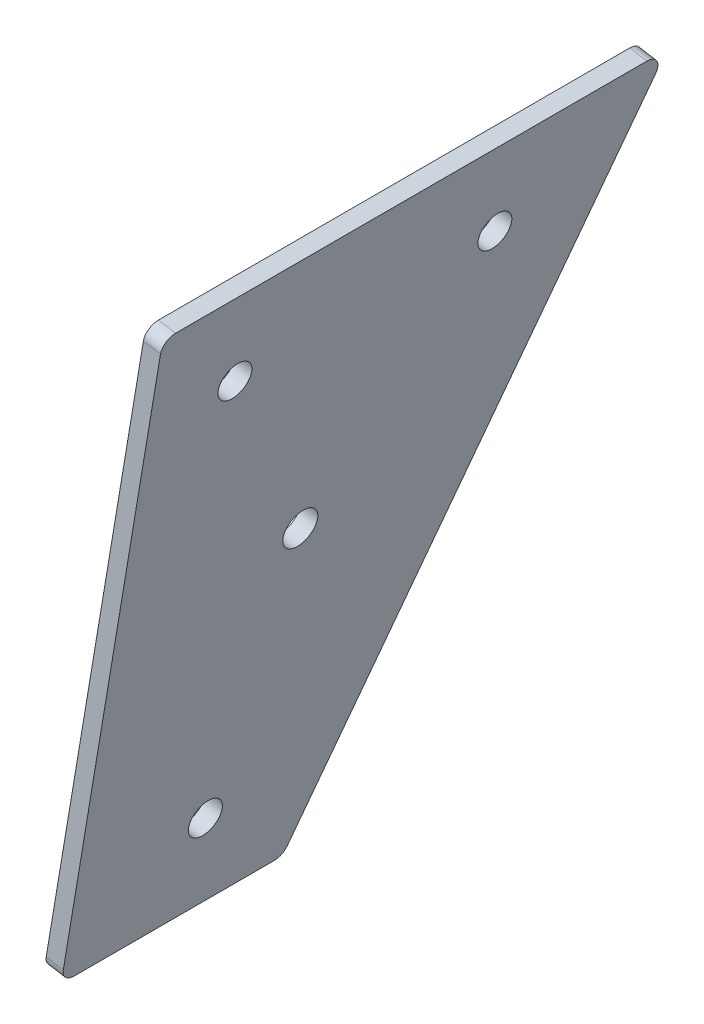
from build123d import *

# Parameters (mm, degrees)
BOSS_EXTRUDE2_START = 10
SKETCH5_R           = 3.875
SKETCH5_R_2         = 4
BOSS_EXTRUDE2_DEPTH = 4
FILLET1_R           = 3
FILLET2_R           = 3


with BuildPart() as part:
    # Sketch5 → Boss-Extrude2 (new body)
    with BuildSketch(Plane(origin=(59.169020247, -9.881108749, 0), x_dir=(0, 0, -1), z_dir=(0.9863408748405357, -0.16471696518211734, 0)).offset(BOSS_EXTRUDE2_START)):
        Polygon((-51.1, 106.13567165), (65.395465612, 106.13567165), (0, -36.047454034), (-51.1, -36.047454034), align=None)
        with Locations(Location((-31.1, 86.13567165, 0), (0, 0, 90))):
            Circle(SKETCH5_R, mode=Mode.SUBTRACT)
        with Locations(Location((28.9, 86.13567165, 0), (0, 0, 90))):
            Circle(SKETCH5_R, mode=Mode.SUBTRACT)
        with Locations(Location((-8.6, 41.13567165, 0), (0, 0, 90))):
            Circle(SKETCH5_R_2, mode=Mode.SUBTRACT)
        with Locations(Location((-21.1, -16.047454034, 0), (0, 0, 90))):
            Circle(SKETCH5_R, mode=Mode.SUBTRACT)
    extrude(amount=BOSS_EXTRUDE2_DEPTH)

    # Fillet1
    fillet1_edges = [part.edges().sort_by_distance(p)[0] for p in [
        (65.067483514, -47.412789679, 0),
        (65.067483514, -47.412789679, 51.1),
    ]]
    fillet(fillet1_edges, radius=FILLET1_R)

    # Fillet2
    fillet2_edges = [part.edges().sort_by_distance(p)[0] for p in [
        (88.487456476, 92.828238896, 51.1),
        (88.487456476, 92.828238896, -65.395465612),
    ]]
    fillet(fillet2_edges, radius=FILLET2_R)


solid = part.part
